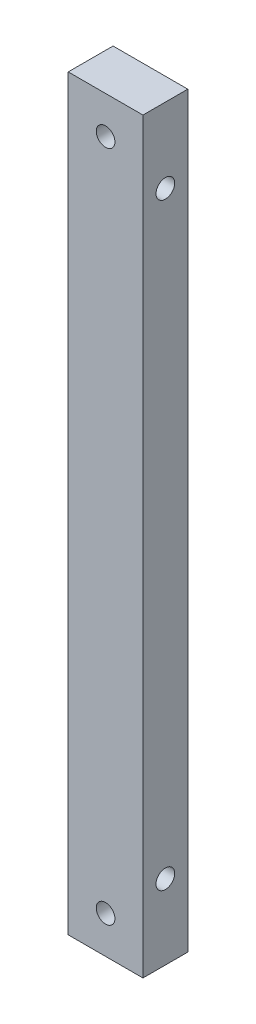
from build123d import *

# Parameters (mm, degrees)
SKETCH1_W                  = 10
SKETCH1_H                  = 100
BOSS_EXTRUDE1_DEPTH        = 6
F_2_5_2_5_DIAMETER_HOLE1_D = 2.5
F_2_5_2_5_DIAMETER_HOLE2_D = 2.5


with BuildPart() as part:
    # Sketch1 → Boss-Extrude1 (new body)
    with BuildSketch(Plane.XY.offset(6)):
        Rectangle(SKETCH1_W, SKETCH1_H)
    extrude(amount=-BOSS_EXTRUDE1_DEPTH)

    # Ø2.5 (2.5) Diameter Hole1 (through all)
    with Locations(Plane.XY.offset(6)):
        with Locations((0, 45), (0, -45)):
            Hole(F_2_5_2_5_DIAMETER_HOLE1_D / 2)

    # Ø2.5 (2.5) Diameter Hole2 (through all)
    with Locations(Plane(origin=(5, 0, 0), x_dir=(0, 0, -1), z_dir=(1, 0, 0))):
        with Locations((-3, 40), (-3, -40)):
            Hole(F_2_5_2_5_DIAMETER_HOLE2_D / 2)


solid = part.part
